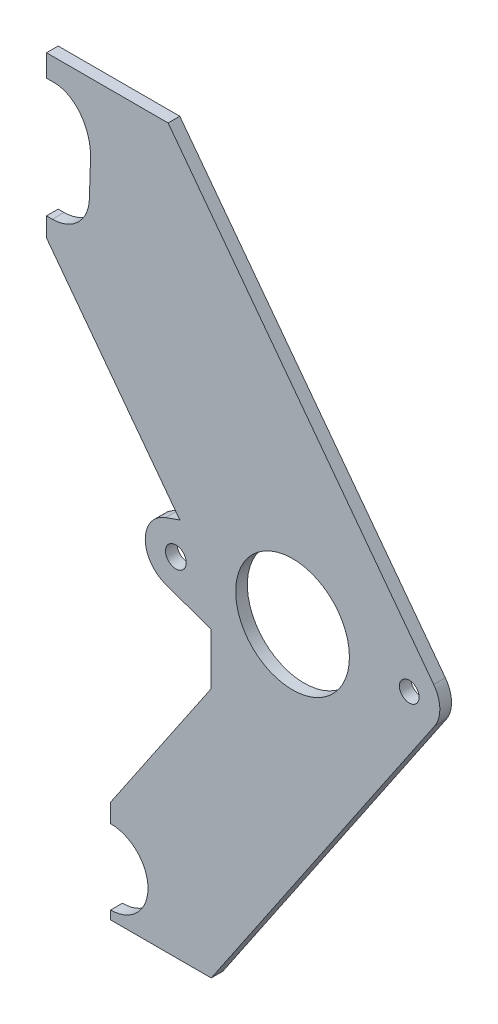
from build123d import *

# Parameters (mm, degrees)
SKETCH1_R           = 3.565769245
SKETCH1_R_2         = 3.386490401
SKETCH1_R_3         = 19.5
BOSS_EXTRUDE1_DEPTH = 4
CUT_EXTRUDE1_DEPTH  = 4


with BuildPart() as part:
    # Sketch1 → Boss-Extrude1 (new body)
    with BuildSketch(Plane.XY):
        with BuildLine():
            ThreePointArc((-43.54375, 9.883918046), (-50.5, 0), (-43.54375, -9.883918046))
            Line((-43.54375, -9.883918046), (-27.881486705, -15.499418427))
            Line((-27.881486705, -15.499418427), (-27.881486705, -33.069179621))
            Line((-27.881486705, -33.069179621), (-62.35, -83.970607053))
            Line((-62.35, -83.970607053), (-62.35, -90.41))
            ThreePointArc((-62.35, -90.41), (-49.55, -103.21), (-62.35, -116.01))
            Line((-62.35, -116.01), (-62.35, -118.970607053))
            Line((-62.35, -118.970607053), (-27.881486705, -118.970607053))
            Line((-27.881486705, -118.970607053), (48.694184993, -5.887371851))
            ThreePointArc((48.694184993, -5.887371851), (50.496841017, 0.257543533), (48.395000292, 6.306660772))
            Line((48.395000292, 6.306660772), (-42.650294732, 127.5))
            Line((-42.650294732, 127.5), (-84.35, 127.5))
            Line((-84.35, 127.5), (-84.35, 72.5))
            Line((-84.35, 72.5), (-38.632989323, 11.644607286))
            Line((-38.632989323, 11.644607286), (-43.54375, 9.883918046))
        make_face()
        with Locations((-40, 0)):
            Circle(SKETCH1_R, mode=Mode.SUBTRACT)
        with Locations((40, 0)):
            Circle(SKETCH1_R_2, mode=Mode.SUBTRACT)
        Circle(SKETCH1_R_3, mode=Mode.SUBTRACT)
    extrude(amount=BOSS_EXTRUDE1_DEPTH)

    # Sketch2 → Cut-Extrude1 (cut)
    with BuildSketch(Plane(origin=(0, 0, 0), x_dir=(-1, 0, 0), z_dir=(0, 0, -1))):
        with BuildLine():
            Line((82.35, 79.081537598), (84.35, 79.081537598))
            Line((84.35, 79.081537598), (84.35, 119.944066118))
            Line((84.35, 119.944066118), (81.764527257, 119.944066118))
            add(Edge.make_bspline(
                [(69.254665804, 103.707956362), (68.93437366, 113.538092856), (74.471506462, 119.944066118), (81.764527257, 119.944066118)],
                knots=[0.236558718, 0.236558718, 0.236558718, 0.236558718, 1, 1, 1, 1], degree=3, weights=[0.82713852, 0.698801532, 0.756422025, 1]))
            Line((69.254665804, 103.707956362), (69.656735992, 91.3679571))
            ThreePointArc((69.656735992, 91.3679571), (73.517176905, 82.656230142), (82.35, 79.081537598))
        make_face()
    extrude(amount=-CUT_EXTRUDE1_DEPTH, mode=Mode.SUBTRACT)


solid = part.part
